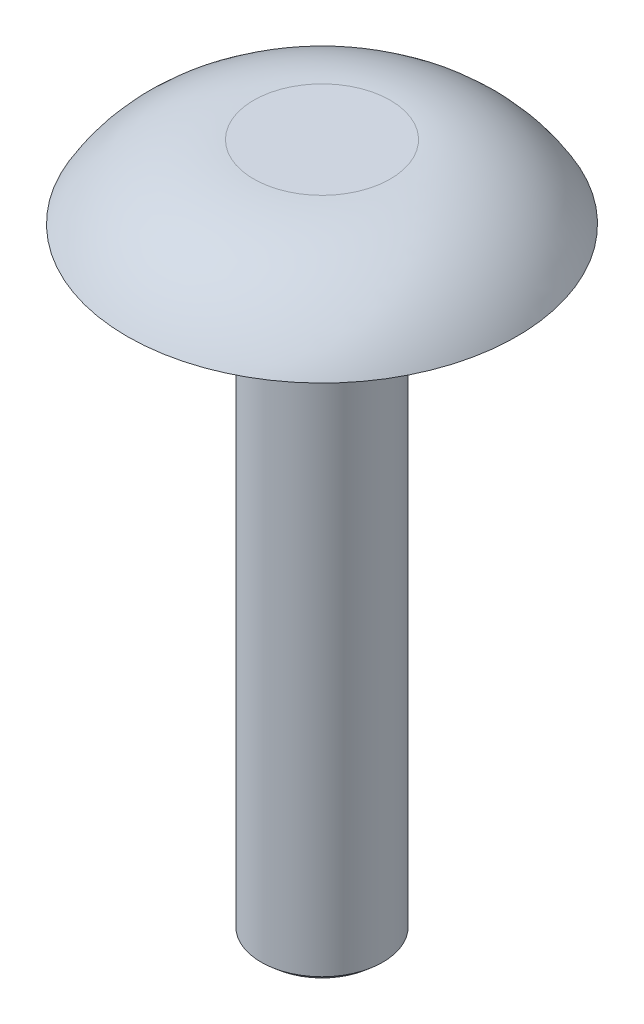
from build123d import *


with BuildPart() as part:
    # Esquisse1 → Révolution1 (revolve)
    with BuildSketch(Plane.XY, mode=Mode.PRIVATE) as r_volution1_sk:
        with BuildLine():
            Line((1.25, 13.5), (1.25, 0.5))
            ThreePointArc((1.25, 0.5), (0.673145601, 0.129635998), (0, 0))
            Line((0, 0), (0, 14.5))
            Line((0, 14.5), (1.401923789, 14.5))
            ThreePointArc((1.401923789, 14.5), (2.901923789, 14.098076211), (4, 13))
            Line((4, 13), (3, 13))
            Line((3, 13), (3, 13.5))
            Line((3, 13.5), (1.25, 13.5))
        make_face()
    revolve(r_volution1_sk.sketch.rotate(Axis((0, 0, 0), (0, 1, 0)), 90), axis=Axis((0, 0, 0), (0, 1, 0)))


solid = part.part
